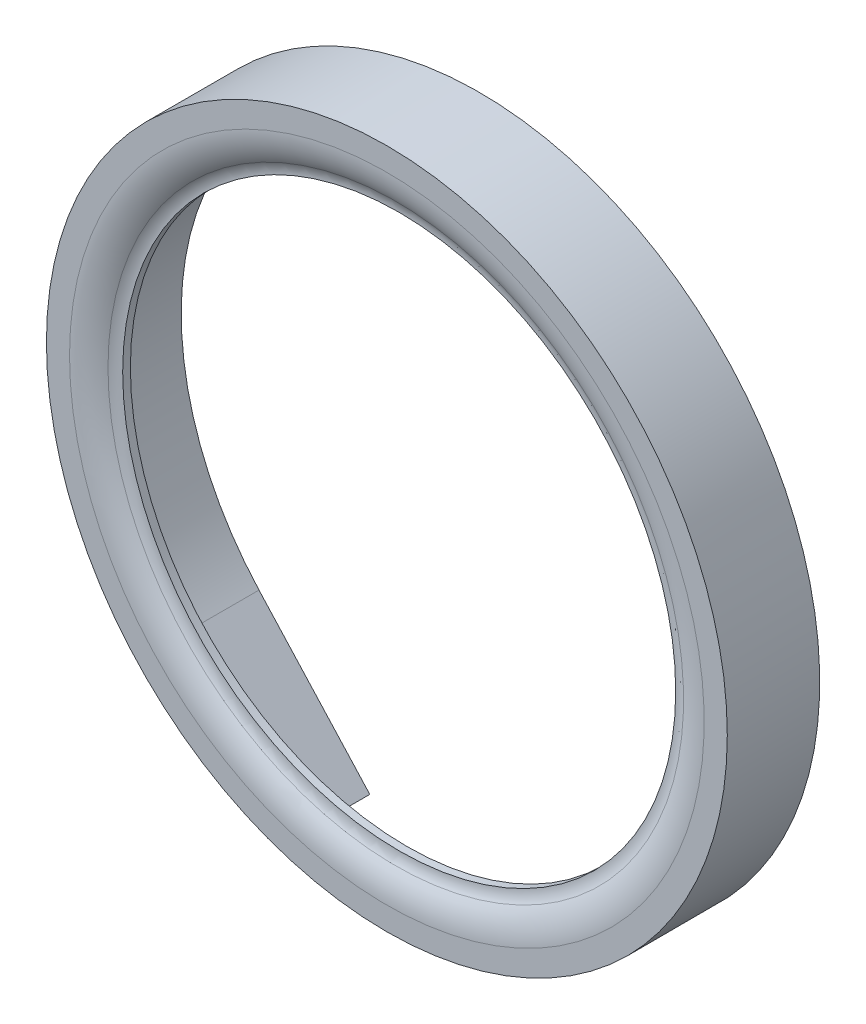
from build123d import *

# Parameters (mm, degrees)
CUT_EXTRUDE_2_DEPTH      = 1
CUT_EXTRUDE_2_DEPTH_BACK = 32.472368834
SKETCH_3_R               = 0.9
CUT_EXTRUDE_3_DEPTH      = 4
PATTERN_CIRCULAR_1_COUNT = 3


with BuildPart() as part:
    # ｽｹｯﾁ1 → 回転1 (revolve)
    with BuildSketch(Plane(origin=(0, 0, 0), x_dir=(1, 0, 0), z_dir=(0, 1, 0)), mode=Mode.PRIVATE) as revolve_1_sk:
        with BuildLine():
            Line((17.95, -1.5), (17.95, 3.7))
            Line((17.95, 3.7), (22.1, 3.7))
            Line((22.1, 3.7), (22.1, -2.3))
            Line((22.1, -2.3), (20.6, -2.3))
            ThreePointArc((20.6, -2.3), (19.598521282, -2.152129029), (18.682513342, -1.721136103))
            ThreePointArc((18.682513342, -1.721136103), (18.332582335, -1.556489289), (17.95, -1.5))
        make_face()
    revolve(revolve_1_sk.sketch.rotate(Axis((0, 0, -23.242467286), (0, 0, 1)), 180), axis=Axis((0, 0, -23.242467286), (0, 0, 1)))

    # ｽｹｯﾁ2 → ｶｯﾄ - 押し出し2 (cut, two sides: drawn at the far end of the back side and taken through both)
    with BuildSketch(Plane.XY.offset(-CUT_EXTRUDE_2_DEPTH_BACK)):
        with BuildLine():
            Line((-14.300155258, -13.03564573), (-8.573902611, -19.317367678))
            Line((-8.573902611, -19.317367678), (-4.755467222, -23.5062065))
            Line((-4.755467222, -23.5062065), (4.755467222, -23.5062065))
            Line((4.755467222, -23.5062065), (8.573902611, -19.317367678))
            Line((8.573902611, -19.317367678), (14.300155258, -13.03564573))
            ThreePointArc((14.300155258, -13.03564573), (0, 19.35), (-14.300155258, -13.03564573))
        make_face()
    extrude(amount=CUT_EXTRUDE_2_DEPTH + CUT_EXTRUDE_2_DEPTH_BACK, mode=Mode.SUBTRACT)

    # ｽｹｯﾁ3 → ｶｯﾄ - 押し出し3 (cut)
    with BuildSketch(Plane(origin=(0, 0, -3.7), x_dir=(-1, 0, 0), z_dir=(0, 0, -1))):
        with Locations((0, 20.35)):
            Circle(SKETCH_3_R)
    cut_extrude_3 = extrude(amount=-CUT_EXTRUDE_3_DEPTH, mode=Mode.SUBTRACT)

    # 円形ﾊﾟﾀｰﾝ1: ｶｯﾄ - 押し出し3 ×3 about axis
    pattern_circular_1_axis = Axis((0, 0, 0), (0, 0, 1))
    for i in range(1, PATTERN_CIRCULAR_1_COUNT):
        add(cut_extrude_3.rotate(pattern_circular_1_axis, i * 360 / PATTERN_CIRCULAR_1_COUNT), mode=Mode.SUBTRACT)


solid = part.part
